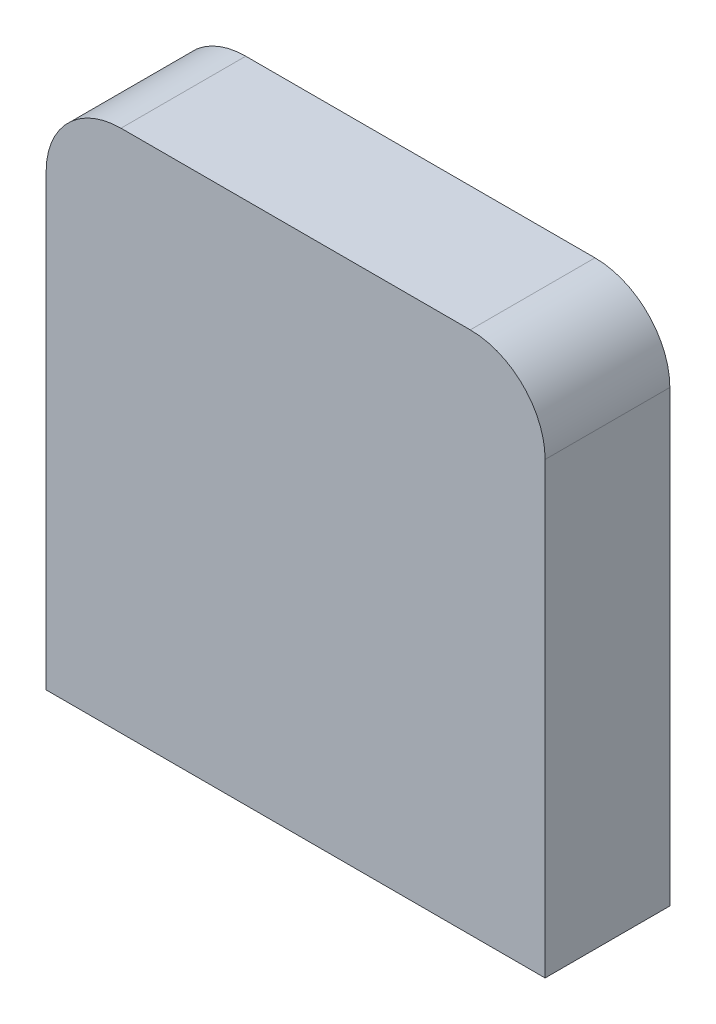
from build123d import *

# Parameters (mm, degrees)
EXTRUDE_1_DEPTH = 5


with BuildPart() as part:
    # 草圖1 → 填料-伸長1 (new body)
    with BuildSketch(Plane.XY):
        with BuildLine():
            Line((-7, 10.5), (7, 10.5))
            ThreePointArc((7, 10.5), (9.121320344, 9.621320344), (10, 7.5))
            Line((10, 7.5), (10, -10.5))
            Line((10, -10.5), (-10, -10.5))
            Line((-10, -10.5), (-10, 7.5))
            ThreePointArc((-10, 7.5), (-9.121320344, 9.621320344), (-7, 10.5))
        make_face()
    extrude(amount=EXTRUDE_1_DEPTH)


solid = part.part
